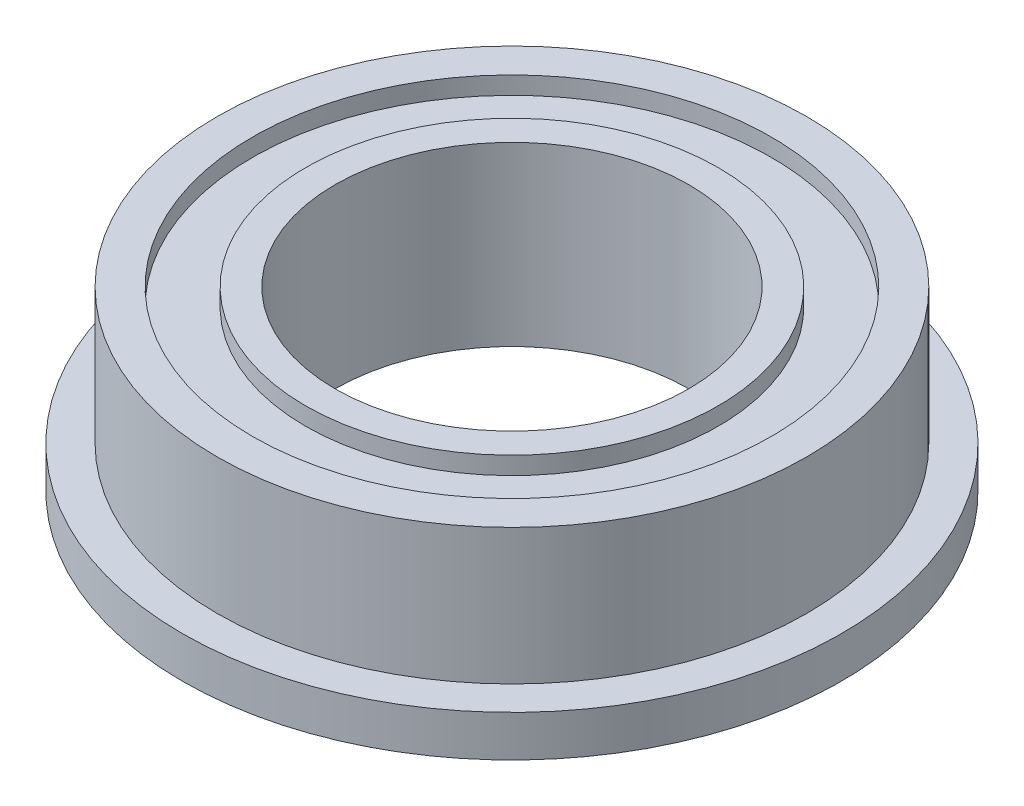
from build123d import *

# Parameters (mm, degrees)
SKETCH1_R           = 5
SKETCH1_R_2         = 3
BOSS_EXTRUDE1_DEPTH = 3
SKETCH2_R           = 5.59
SKETCH2_R_2         = 5
BOSS_EXTRUDE2_DEPTH = 0.7
SKETCH3_R           = 4.4
SKETCH3_R_2         = 3.5
CUT_EXTRUDE1_DEPTH  = 0.3
CUT_EXTRUDE2_START  = 0.3
SKETCH4_R           = 4.4
SKETCH4_R_2         = 3.5
CUT_EXTRUDE2_DEPTH  = 0.3


with BuildPart() as part:
    # Sketch1 → Boss-Extrude1 (new body)
    with BuildSketch(Plane(origin=(0, 0, 0), x_dir=(1, 0, 0), z_dir=(0, 1, 0))):
        with Locations(Location((0, 0, 0), (0, 0, 270))):
            Circle(SKETCH1_R)
        with Locations(Location((0, 0, 0), (0, 0, 270))):
            Circle(SKETCH1_R_2, mode=Mode.SUBTRACT)
    extrude(amount=BOSS_EXTRUDE1_DEPTH)

    # Sketch2 → Boss-Extrude2 (add)
    with BuildSketch(Plane(origin=(0, 0, 0), x_dir=(1, 0, 0), z_dir=(0, 1, 0))):
        with Locations(Location((0, 0, 0), (0, 0, 270))):
            Circle(SKETCH2_R)
        with Locations(Location((0, 0, 0), (0, 0, 270))):
            Circle(SKETCH2_R_2, mode=Mode.SUBTRACT)
    extrude(amount=BOSS_EXTRUDE2_DEPTH)

    # Sketch3 → Cut-Extrude1 (cut)
    with BuildSketch(Plane(origin=(0, 3, 0), x_dir=(1, 0, 0), z_dir=(0, 1, 0))):
        with Locations(Location((0, 0, 0), (0, 0, 270))):
            Circle(SKETCH3_R)
        with Locations(Location((0, 0, 0), (0, 0, 270))):
            Circle(SKETCH3_R_2, mode=Mode.SUBTRACT)
    extrude(amount=-CUT_EXTRUDE1_DEPTH, mode=Mode.SUBTRACT)

    # Sketch4 → Cut-Extrude2 (cut)
    with BuildSketch(Plane(origin=(0, 0, 0), x_dir=(1, 0, 0), z_dir=(0, 1, 0)).offset(CUT_EXTRUDE2_START)):
        with Locations(Location((0, 0, 0), (0, 0, 270))):
            Circle(SKETCH4_R)
        with Locations(Location((0, 0, 0), (0, 0, 270))):
            Circle(SKETCH4_R_2, mode=Mode.SUBTRACT)
    extrude(amount=-CUT_EXTRUDE2_DEPTH, mode=Mode.SUBTRACT)


solid = part.part
